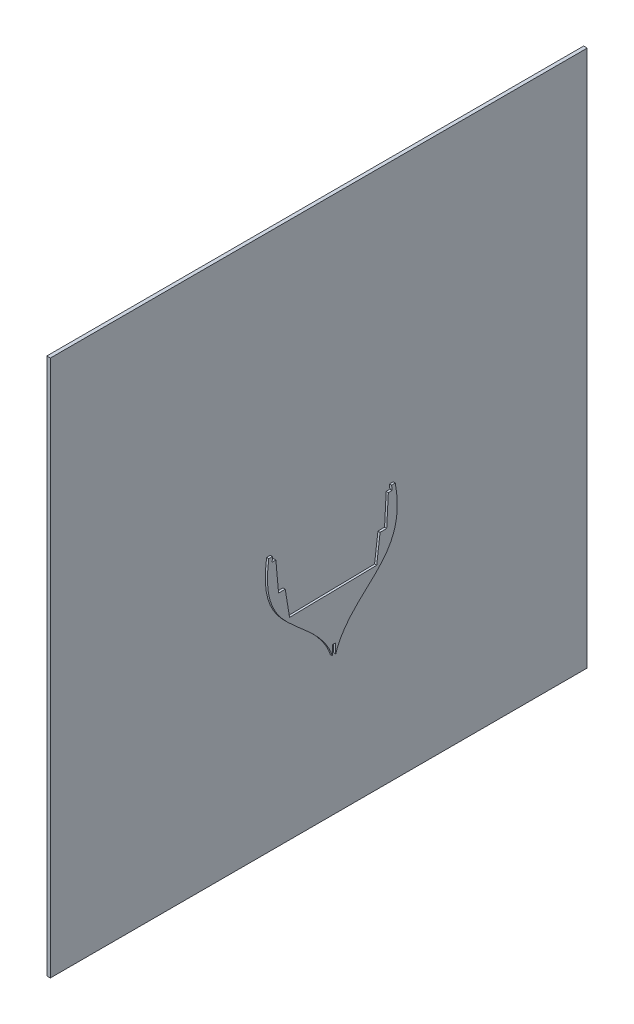
from build123d import *

# Parameters (mm, degrees)
BOSS_EXTRU_2_DEPTH      = 10
BOSS_EXTRU_3_DEPTH      = 6
ENL_V_MAT_EXTRU_1_DEPTH = 6


with BuildPart() as part:
    # Esquisse3D1 → Boss.-Extru.2 (new body)
    with BuildSketch(Plane(origin=(-20, 1121.289346724, 777.274991403), x_dir=(0, -0.7071067811865476, -0.7071067811865476), z_dir=(1, 0, 0))):
        Polygon((0, 0), (1060.66017178, 1060.66017178), (2121.32034356, 0), (1060.66017178, -1060.66017178), align=None)
    extrude(amount=BOSS_EXTRU_2_DEPTH)


with BuildPart() as body_2:
    # Esquisse5 → Boss.-Extru.3 (new body)
    with BuildSketch(Plane(origin=(0, 0, 0), x_dir=(0, 0, -1), z_dir=(1, 0, 0))):
        with BuildLine():
            Line((170.383777642, 353.076700453), (160.383777642, 352.895546681))
            Line((160.383777642, 352.895546681), (161.193423341, 339.76455833))
            Line((161.193423341, 339.76455833), (151.0185207, 339.58023613))
            Line((151.0185207, 339.58023613), (146.47299258, 255.274664597))
            Line((146.47299258, 255.274664597), (127.994738238, 254.939924049))
            Line((127.994738238, 254.939924049), (118.526672474, 180.005385852))
            Line((118.526672474, 180.005385852), (-124.968496367, 175.594379009))
            Line((-124.968496367, 175.594379009), (-137.144394156, 250.13682864))
            Line((-137.144394156, 250.13682864), (-155.622648498, 249.802088092))
            Line((-155.622648498, 249.802088092), (-163.218646637, 333.887711296))
            Line((-163.218646637, 333.887711296), (-173.393549279, 333.703389096))
            Line((-173.393549279, 333.703389096), (-173.060024345, 346.855086414))
            Line((-173.060024345, 346.855086414), (-183.060024345, 346.673932641))
            add(Edge.make_bspline(
                [(0, 0), (-0.449894327, 24.834941105), (-39.194079735, 169.74917454), (-216.476501704, 122.4853477), (-183.060024345, 346.673932641)],
                knots=[0, 0, 0, 0, 0, 1, 1, 1, 1, 1], degree=4))
            add(Edge.make_bspline(
                [(0, 0), (-0.449894327, 24.834941105), (33.020240715, 171.057364198), (211.898186749, 130.245516788), (170.383777642, 353.076700453)],
                knots=[0, 0, 0, 0, 0, 1, 1, 1, 1, 1], degree=4))
        make_face()
    extrude(amount=BOSS_EXTRU_3_DEPTH)

    # Esquisse6 → Enlèv. mat.-Extru.1 (cut)
    with BuildSketch(Plane(origin=(6, 0, 0), x_dir=(0, 0, -1), z_dir=(1, 0, 0))):
        Polygon((-4.91259852, 22.694629144), (-5.401713706, 49.694629144), (3.598286294, 49.85766754), (4.08740148, 22.85766754), (117.063261114, -47.52702125), (-85.227699586, -65.220017949), align=None)
    extrude(amount=-ENL_V_MAT_EXTRU_1_DEPTH, mode=Mode.SUBTRACT)


solid = Compound([part.part, body_2.part])
